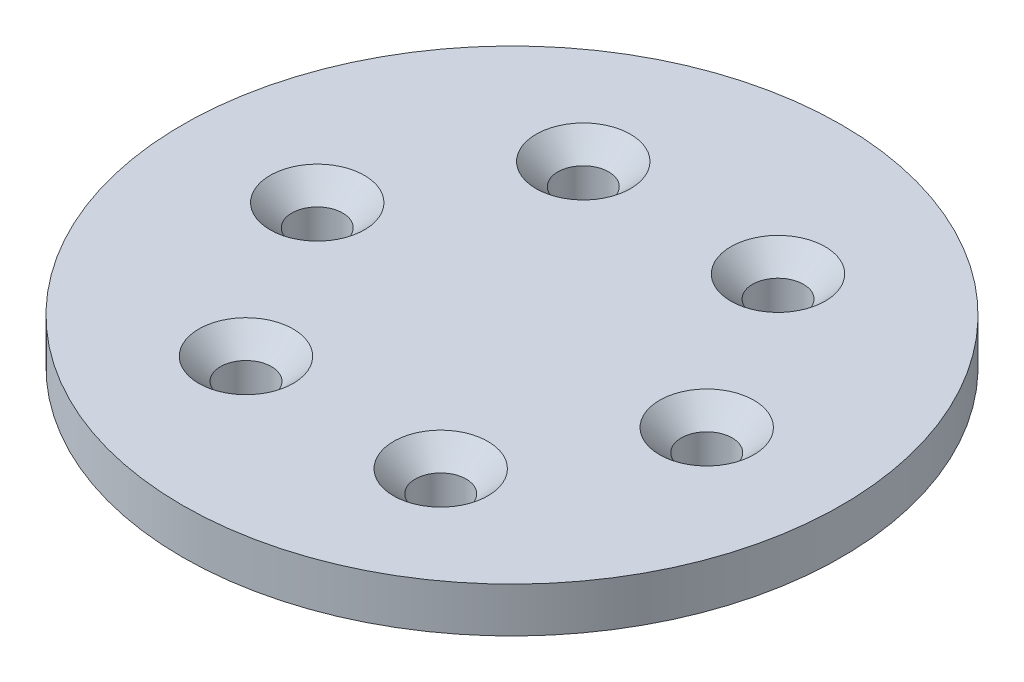
from build123d import *

# Parameters (mm, degrees)
HOLE_WIZARD_M31_D           = 3.4
HOLE_WIZARD_M31_CSINK_D     = 6.3
HOLE_WIZARD_M31_CSINK_ANGLE = 90


with BuildPart() as part:
    # Эскиз1 → Повернуть1 (revolve)
    with BuildSketch(Plane(origin=(0, 0, 0), x_dir=(0, 0, -1), z_dir=(1, 0, 0))):
        Polygon((22, 1), (22, 4), (0, 4), (0, 0), (19.5, 0), align=None)
    revolve(axis=Axis((0, 0, 0), (0, 1, 0)))

    # Зенковка для винта с полупотайной головкой M31 (through all)
    with Locations(Plane(origin=(0, 4, 0), x_dir=(1, 0, 0), z_dir=(0, 1, 0))):
        with Locations((6.5, 11.258330249), (13, 0), (6.5, -11.258330249), (-6.5, -11.258330249), (-13, 0), (-6.5, 11.258330249)):
            CounterSinkHole(HOLE_WIZARD_M31_D / 2, HOLE_WIZARD_M31_CSINK_D / 2, counter_sink_angle=HOLE_WIZARD_M31_CSINK_ANGLE)


solid = part.part
